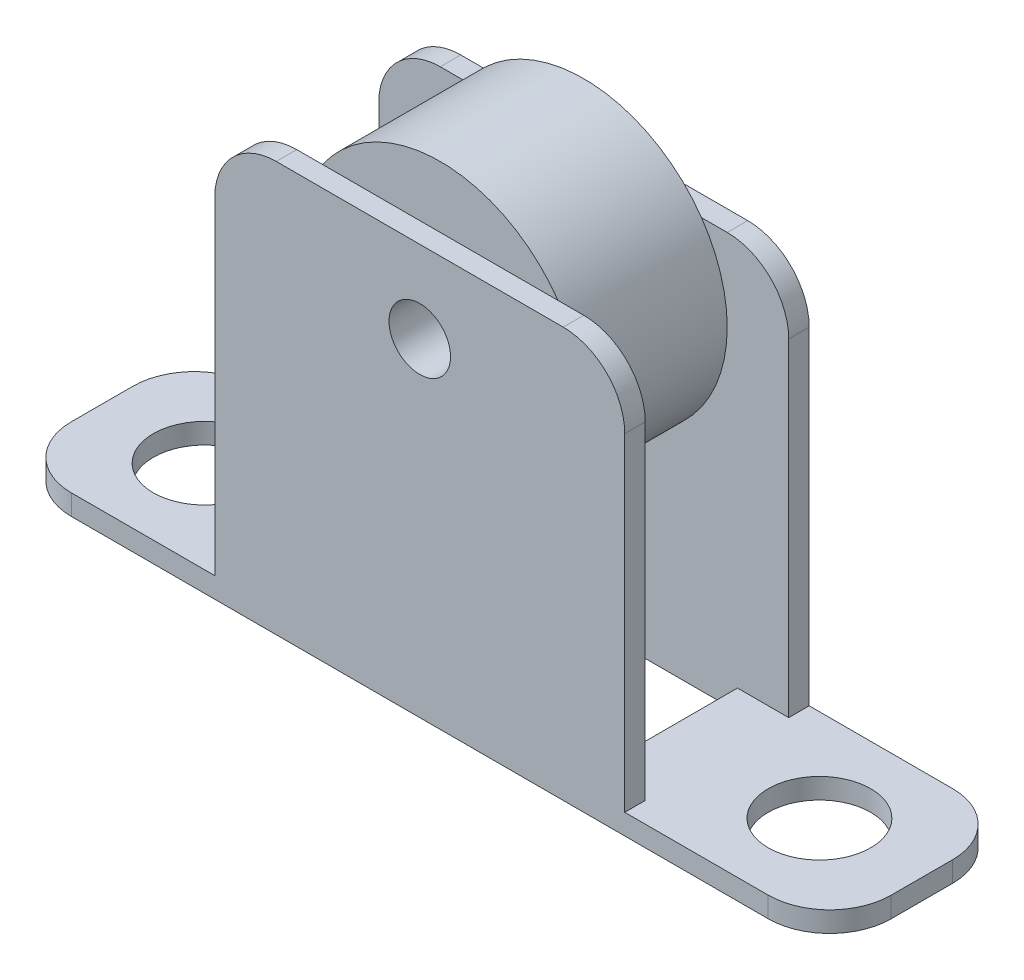
from build123d import *

# Parameters (mm, degrees)
SKETCH_1_W                = 40
SKETCH_1_H                = 9
SKETCH_1_W_2              = 15
SKETCH_1_H_2              = 7
EXTRUDE_1_DEPTH           = 1
SKETCH_2_W                = 20
SKETCH_2_H                = 20
SKETCH_2_R                = 1.5
EXTRUDE_2_DEPTH           = 1
EXTRUDE_START             = -8
SKETCH_2_2_W              = 20
SKETCH_2_2_H              = 20
SKETCH_2_2_R              = 1.5
EXTRUDE_3_DEPTH           = 1
HOLE_WIZARD_5_0_5_1_D     = 5
HOLE_WIZARD_5_0_5_1_DEPTH = 6
EXTRUDE_START_2           = 7
SKETCH_5_R                = 7
SKETCH_5_R_2              = 1.5
EXTRUDE_4_DEPTH           = 7
FILLET_1_R                = 3


with BuildPart() as part:
    # 草图1 → 凸台-拉伸1 (new body)
    with BuildSketch(Plane(origin=(0, 0, 0), x_dir=(1, 0, 0), z_dir=(0, 1, 0))):
        with Locations((20, 4.5)):
            Rectangle(SKETCH_1_W, SKETCH_1_H)
        with Locations((20, 4.5)):
            Rectangle(SKETCH_1_W_2, SKETCH_1_H_2, mode=Mode.SUBTRACT)
    extrude(amount=EXTRUDE_1_DEPTH)

    # 草图2 → 凸台-拉伸2 (add)
    with BuildSketch(Plane.XY):
        with Locations((20, 10)):
            Rectangle(SKETCH_2_W, SKETCH_2_H)
        with Locations((20, 16)):
            Circle(SKETCH_2_R, mode=Mode.SUBTRACT)
    extrude(amount=-EXTRUDE_2_DEPTH)

    # 草图2<2> → 凸台-拉伸3 (add)
    with BuildSketch(Plane.XY.offset(EXTRUDE_START)):
        with Locations((20, 10)):
            Rectangle(SKETCH_2_2_W, SKETCH_2_2_H)
        with Locations((20, 16)):
            Circle(SKETCH_2_2_R, mode=Mode.SUBTRACT)
    extrude(amount=-EXTRUDE_3_DEPTH)

    # Ø5.0 (5) 直径孔1
    with Locations(Plane(origin=(0, 1, 0), x_dir=(1, 0, 0), z_dir=(0, 1, 0))):
        with Locations((35, 4.5), (5, 4.5)):
            Hole(HOLE_WIZARD_5_0_5_1_D / 2, depth=HOLE_WIZARD_5_0_5_1_DEPTH)

    # 草图5 → 凸台-拉伸4 (add)
    with BuildSketch(Plane.XY.offset(-8).offset(EXTRUDE_START_2)):
        with Locations(Location((20, 16, 0), (0, 0, 145.150095421))):
            Circle(SKETCH_5_R)
        with Locations((20, 16)):
            Circle(SKETCH_5_R_2, mode=Mode.SUBTRACT)
    extrude(amount=-EXTRUDE_4_DEPTH)

    # 圆角1
    fillet_1_edges = [part.edges().sort_by_distance(p)[0] for p in [
        (30, 20, -0.5),
        (10, 20, -0.5),
        (10, 20, -8.5),
        (30, 20, -8.5),
        (0, 0.5, -9),
        (40, 0.5, -9),
        (40, 0.5, 0),
        (0, 0.5, 0),
    ]]
    fillet(fillet_1_edges, radius=FILLET_1_R)


solid = part.part
